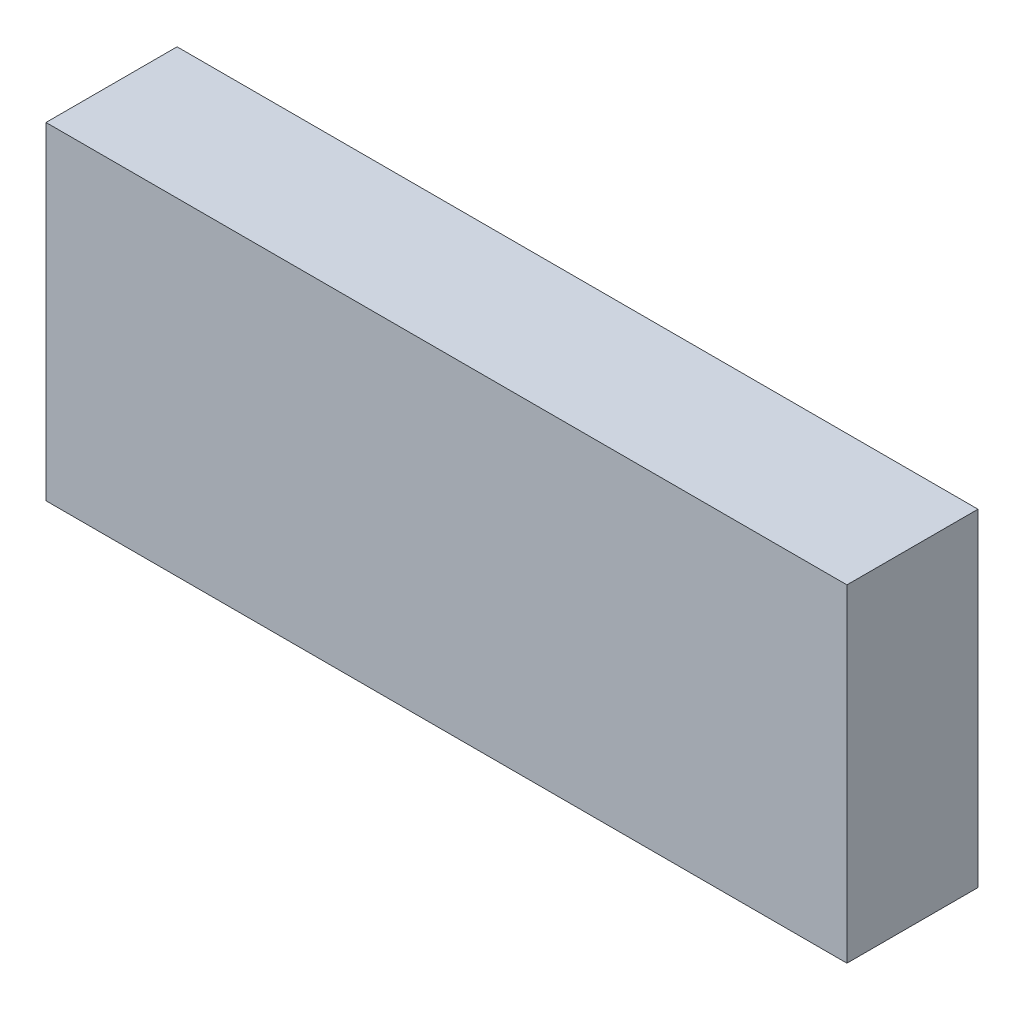
from build123d import *

# Parameters (mm, degrees)
SKETCH1_W           = 110
SKETCH1_H           = 45
BOSS_EXTRUDE1_DEPTH = 18


with BuildPart() as part:
    # Sketch1 → Boss-Extrude1 (new body)
    with BuildSketch(Plane.XY):
        with Locations((7.536443149, -7.164723032)):
            Rectangle(SKETCH1_W, SKETCH1_H)
    extrude(amount=BOSS_EXTRUDE1_DEPTH)


solid = part.part
